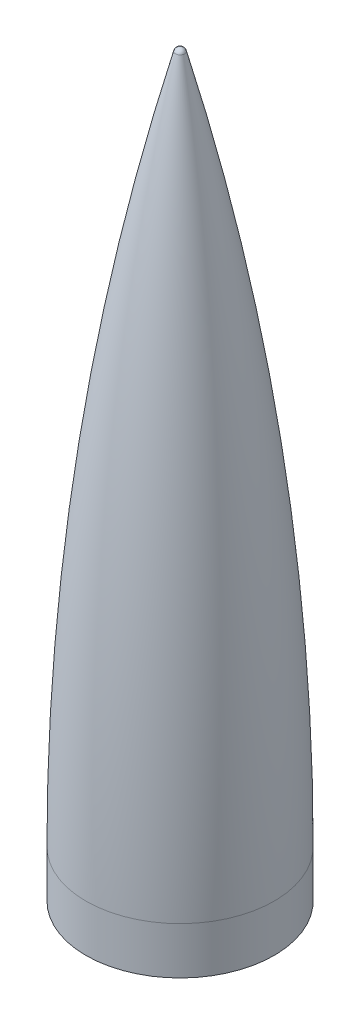
from build123d import *


with BuildPart() as part:
    # Sketch2 → Revolve1 (revolve)
    with BuildSketch(Plane.XY, mode=Mode.PRIVATE) as revolve1_sk:
        with BuildLine():
            Line((40, 0), (40, -20))
            Line((40, -20), (38, -20))
            Line((38, -20), (38, 0))
            ThreePointArc((38, 0), (28.460188979, 147.36688909), (0, 292.273844194))
            Line((0, 292.273844194), (0, 294.273844194))
            ThreePointArc((0, 294.273844194), (1.220075694, 293.858588748), (1.933508311, 292.785259495))
            ThreePointArc((1.933508311, 292.785259495), (30.443496396, 147.624748913), (40, 0))
        make_face()
    revolve(revolve1_sk.sketch.rotate(Axis((0, 294.273844194, 0), (0, -1, 0)), 90), axis=Axis((0, 294.273844194, 0), (0, -1, 0)))


solid = part.part
